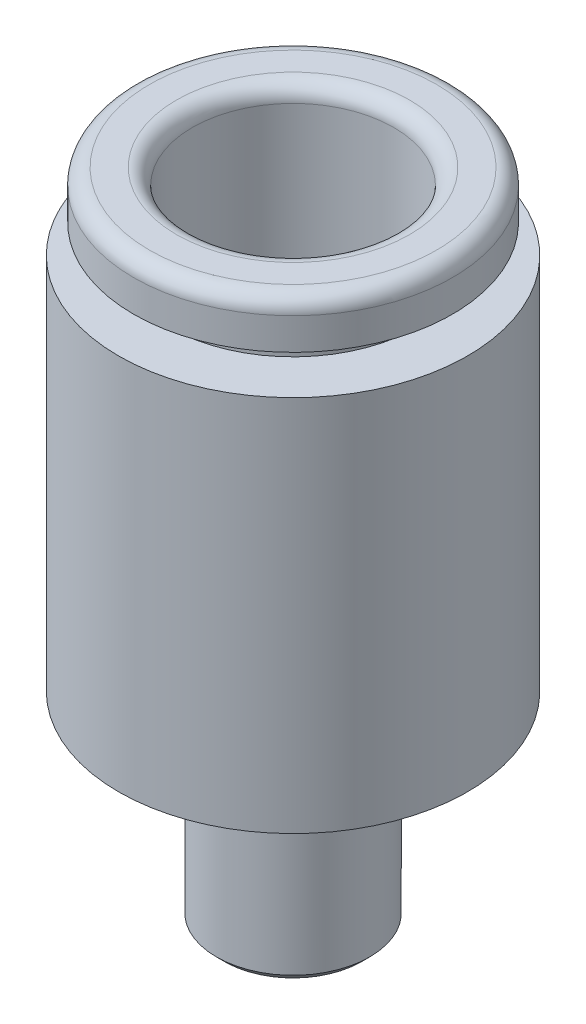
from build123d import *

# Parameters (mm, degrees)
UBODY_SKETCH_R      = 5.5
UBODY_DEPTH         = 11.9
THREAD_SKETCH_W     = 2.415
THREAD_SKETCH_H     = 6.3
THREAD_CHAMFER_SIZE = 0.25
TUBE_START          = -13.3
TUBE_SKETCH_R       = 3.175
TUBE_DEPTH          = 13.3
TUBE_RADIUS_R       = 0.5
HEX_2_DEPTH         = 2
HEX_2_DRAFT         = -2
PORT_SKETCH_R       = 0.930158461
PORT_DEPTH          = 18.163624326


with BuildPart() as part:
    # Release_Sketch → Release (revolve)
    with BuildSketch(Plane.XY, mode=Mode.PRIVATE) as release_sk:
        with BuildLine():
            Line((0, 0), (-4.525, 0))
            ThreePointArc((-4.525, 0), (-4.878553391, -0.146446609), (-5.025, -0.5))
            Line((-5.025, -0.5), (-5.025, -1.5))
            Line((-5.025, -1.5), (-3.925, -1.5))
            Line((-3.925, -1.5), (-3.925, -2.4))
            Line((-3.925, -2.4), (0, -2.4))
            Line((0, -2.4), (0, 0))
        make_face()
    revolve(release_sk.sketch.rotate(Axis((0, 0, 0), (0, -1, 0)), 270), axis=Axis((0, 0, 0), (0, -1, 0)))

    # UBody_Sketch → UBody (add)
    with BuildSketch(Plane(origin=(0, -2.4, 0), x_dir=(-1, 0, 0), z_dir=(0, 1, 0))):
        with Locations(Location((0, 0, 0), (0, 0, 90))):
            Circle(UBODY_SKETCH_R)
    extrude(amount=-UBODY_DEPTH)

    # Thread_Sketch → Thread (revolve)
    with BuildSketch(Plane.XY, mode=Mode.PRIVATE) as thread_sk:
        with Locations((-1.2075, -17.45)):
            Rectangle(THREAD_SKETCH_W, THREAD_SKETCH_H)
    revolve(thread_sk.sketch.rotate(Axis((0, 0, 0), (0, -1, 0)), 270), axis=Axis((0, 0, 0), (0, -1, 0)))

    # Thread_Chamfer
    thread_chamfer_edges = [part.edges().sort_by_distance(p)[0] for p in [
        (0, -20.6, -2.415),
    ]]
    chamfer(thread_chamfer_edges, length=THREAD_CHAMFER_SIZE)

    # Tube_Sketch → Tube (cut)
    with BuildSketch(Plane(origin=(0, 0, 0), x_dir=(1, 0, 0), z_dir=(0, 1, 0)).offset(TUBE_START)):
        with Locations(Location((0, 0, 0), (0, 0, 270))):
            Circle(TUBE_SKETCH_R)
    extrude(amount=TUBE_DEPTH, mode=Mode.SUBTRACT)

    # Tube_Radius
    tube_radius_edges = [part.edges().sort_by_distance(p)[0] for p in [
        (0, 0, -3.175),
    ]]
    fillet(tube_radius_edges, radius=TUBE_RADIUS_R)


with BuildPart() as hex_2_tool:
    # Hex_Sketch → Hex 2 (with draft: the straight prism first)
    with BuildSketch(Plane(origin=(0, -13.3, 0), x_dir=(-1, 0, 0), z_dir=(0, 1, 0))):
        Polygon((-1.154700538, 0), (-0.577350269, -1), (0.577350269, -1), (1.154700538, 0), (0.577350269, 1), (-0.577350269, 1), align=None)
    extrude(amount=-HEX_2_DEPTH)
    # Hex 2: the draft: its side faces are tilted about the plane it starts from
    hex_2_sides = [hex_2_tool.faces().sort_by_distance(p)[0] for p in [
        (0.866025404, -14.3, -0.5),
        (0, -14.3, -1),
        (-0.866025404, -14.3, -0.5),
        (-0.866025404, -14.3, 0.5),
        (0, -14.3, 1),
        (0.866025404, -14.3, 0.5),
    ]]
    draft(hex_2_sides, Plane(origin=(0, -13.3, 0), x_dir=(-1, 0, 0), z_dir=(0, 1, 0)), HEX_2_DRAFT)


with BuildPart() as part_1:
    add(part.part)

    # Hex 2: cut by hex_2_tool
    add(hex_2_tool.part, mode=Mode.SUBTRACT)

    # Port_Sketch → Port (cut, through all)
    with BuildSketch(Plane(origin=(0, -15.3, 0), x_dir=(-1, 0, 0), z_dir=(0, 1, 0))):
        with Locations(Location((0, 0, 0), (0, 0, 90))):
            Circle(PORT_SKETCH_R)
    extrude(amount=-PORT_DEPTH, mode=Mode.SUBTRACT)


solid = part_1.part
